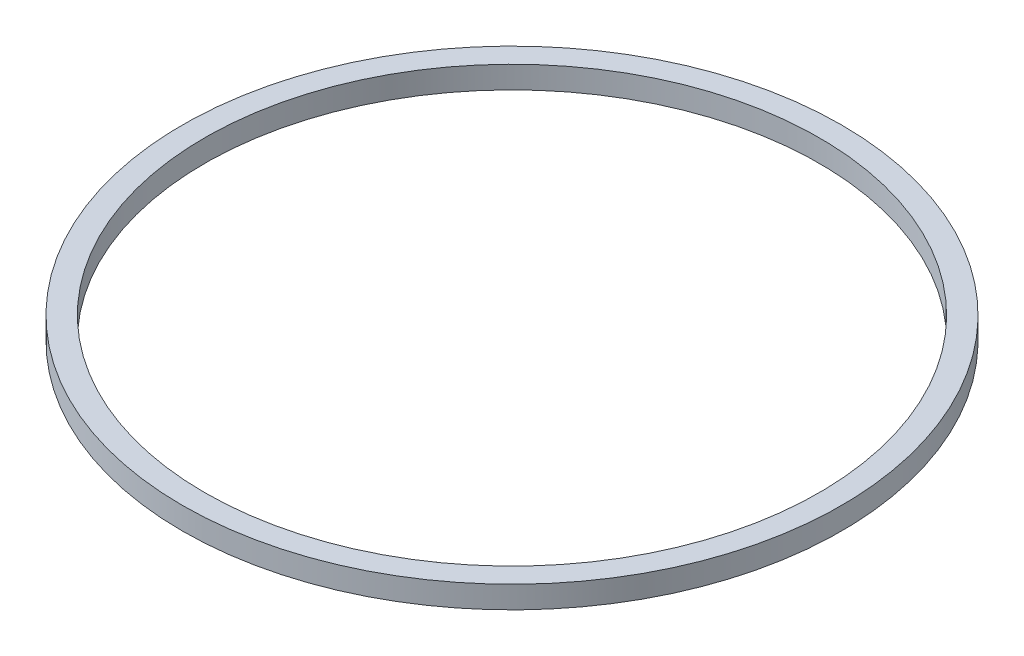
from build123d import *

# Parameters (mm, degrees)
SKETCH1_R           = 44.5
SKETCH1_R_2         = 41.5
BOSS_EXTRUDE1_DEPTH = 3


with BuildPart() as part:
    # Sketch1 → Boss-Extrude1 (new body)
    with BuildSketch(Plane(origin=(0, 0, 0), x_dir=(1, 0, 0), z_dir=(0, 1, 0))):
        with Locations(Location((0, 0, 0), (0, 0, 270))):
            Circle(SKETCH1_R)
        with Locations(Location((0, 0, 0), (0, 0, 270))):
            Circle(SKETCH1_R_2, mode=Mode.SUBTRACT)
    extrude(amount=BOSS_EXTRUDE1_DEPTH)


solid = part.part
